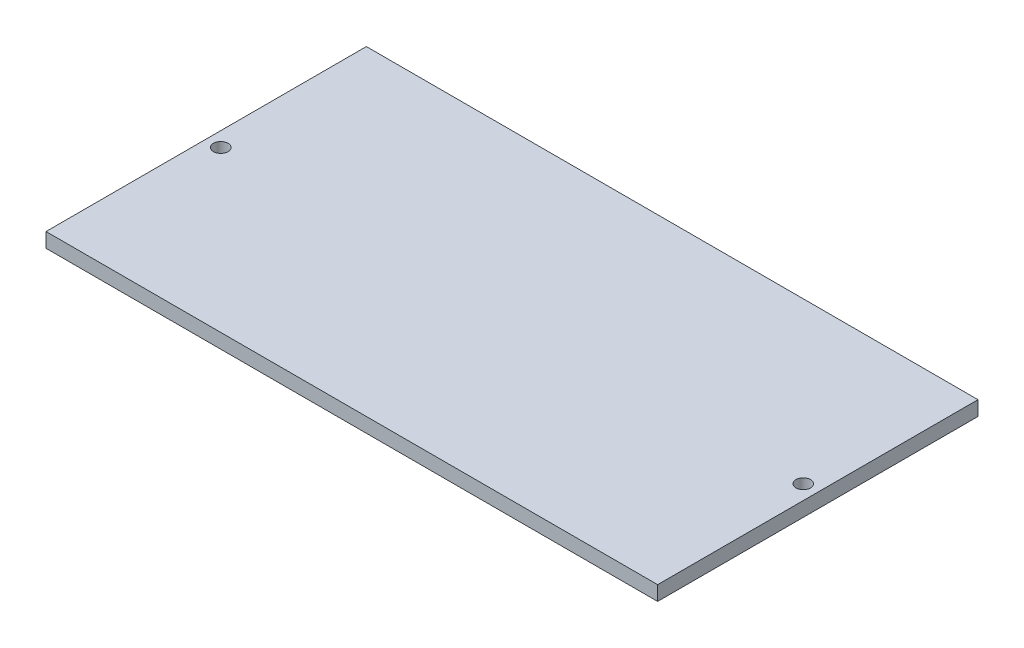
from build123d import *

# Parameters (mm, degrees)
SKETCH1_W           = 84
SKETCH1_H           = 44
BOSS_EXTRUDE1_DEPTH = 2
SKETCH2_R           = 1
CUT_EXTRUDE1_DEPTH  = 10


with BuildPart() as part:
    # Sketch1 → Boss-Extrude1 (new body)
    with BuildSketch(Plane(origin=(0, 0, 0), x_dir=(1, 0, 0), z_dir=(0, 1, 0))):
        Rectangle(SKETCH1_W, SKETCH1_H)
    extrude(amount=BOSS_EXTRUDE1_DEPTH)

    # Sketch2 → Cut-Extrude1 (cut)
    with BuildSketch(Plane(origin=(0, 2, 0), x_dir=(1, 0, 0), z_dir=(0, 1, 0))):
        with Locations(Location((-40, 0, 0), (0, 0, 270))):
            Circle(SKETCH2_R)
        with Locations(Location((40, 0, 0), (0, 0, 270))):
            Circle(SKETCH2_R)
    extrude(amount=-CUT_EXTRUDE1_DEPTH, mode=Mode.SUBTRACT)


solid = part.part
